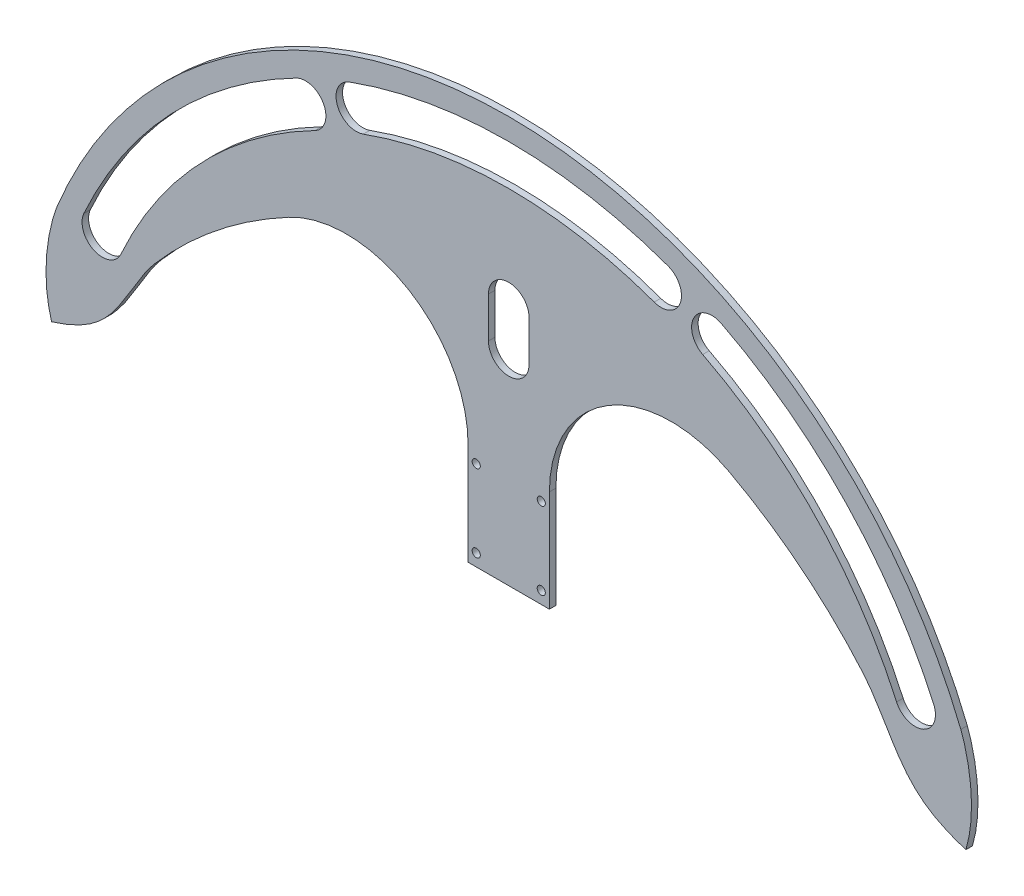
from build123d import *

# Parameters (mm, degrees)
EXTRUDE_2_DEPTH     = 1.6
SKETCH_2_R          = 1
CUT_EXTRUDE_1_DEPTH = 152.556112047


with BuildPart() as part:
    # 草图1 → 凸台-拉伸2 (new body)
    with BuildSketch(Plane.XY):
        with BuildLine():
            Line((-10, 0), (10, 0))
            Line((10, 0), (10, 25))
            ThreePointArc((10, 25), (24.565127337, 50.724787771), (54.117647059, 51.470588235))
            ThreePointArc((54.117647059, 51.470588235), (71.876884233, 39.7703376), (87.177978871, 25))
            add(Edge.make_bspline(
                [(87.177978871, 25), (90.304994573, 21.365241216), (96.247853251, 9.443363931), (103.450341903, 2.775811449), (112.5, 0)],
                knots=[0, 0, 0, 0, 0.44500112, 1, 1, 1, 1], degree=3))
            add(Edge.make_bspline(
                [(111.242977306, 25), (112.528770299, 21.821434652), (115.6681563, 10.742987267), (112.5, 0)],
                knots=[0, 0, 0, 0, 1, 1, 1, 1], degree=3))
            ThreePointArc((111.242977306, 25), (0, 100), (-111.242977306, 25))
            add(Edge.make_bspline(
                [(-111.242977306, 25), (-112.528770299, 21.821434652), (-115.6681563, 10.742987267), (-112.5, 0)],
                knots=[0, 0, 0, 0, 1, 1, 1, 1], degree=3))
            add(Edge.make_bspline(
                [(-87.177978871, 25), (-90.304994573, 21.365241216), (-96.247853251, 9.443363931), (-103.450341903, 2.775811449), (-112.5, 0)],
                knots=[0, 0, 0, 0, 0.44500112, 1, 1, 1, 1], degree=3))
            ThreePointArc((-87.177978871, 25), (-71.876884233, 39.7703376), (-54.117647059, 51.470588235))
            ThreePointArc((-54.117647059, 51.470588235), (-24.565127337, 50.724787771), (-10, 25))
            Line((-10, 25), (-10, 0))
        make_face()
        with BuildLine():
            Line((5, 59.658560997), (5, 49.658560997))
            ThreePointArc((5, 49.658560997), (0, 44.658560997), (-5, 49.658560997))
            Line((-5, 49.658560997), (-5, 59.658560997))
            ThreePointArc((-5, 59.658560997), (0, 64.658560997), (5, 59.658560997))
        make_face(mode=Mode.SUBTRACT)
        with BuildLine():
            ThreePointArc((-52.279803763, 82.046105896), (-83.1008003, 58.999003788), (-104.559607526, 27.051823387))
            ThreePointArc((-104.559607526, 27.051823387), (-102.051823387, 20.440392474), (-95.440392474, 22.948176613))
            ThreePointArc((-95.440392474, 22.948176613), (-75.853125153, 52.10906874), (-47.720196237, 73.146107064))
            ThreePointArc((-47.720196237, 73.146107064), (-45.550000584, 79.875910243), (-52.279803763, 82.046105896))
        make_face(mode=Mode.SUBTRACT)
        with BuildLine():
            ThreePointArc((52.279803763, 82.046105896), (83.1008003, 58.999003788), (104.559607526, 27.051823387))
            ThreePointArc((104.559607526, 27.051823387), (102.051823387, 20.440392474), (95.440392474, 22.948176613))
            ThreePointArc((95.440392474, 22.948176613), (75.853125153, 52.10906874), (47.720196237, 73.146107064))
            ThreePointArc((47.720196237, 73.146107064), (45.550000584, 79.875910243), (52.279803763, 82.046105896))
        make_face(mode=Mode.SUBTRACT)
        with BuildLine():
            ThreePointArc((39.209852822, 87.74587255), (0, 94.658560997), (-39.209852822, 87.74587255))
            ThreePointArc((-39.209852822, 87.74587255), (-42.198553323, 81.337466405), (-35.790147178, 78.348765905))
            ThreePointArc((-35.790147178, 78.348765905), (0, 84.658560997), (35.790147178, 78.348765905))
            ThreePointArc((35.790147178, 78.348765905), (42.198553323, 81.337466405), (39.209852822, 87.74587255))
        make_face(mode=Mode.SUBTRACT)
    extrude(amount=EXTRUDE_2_DEPTH)

    # 草图2 → 切除-拉伸1 (cut, through all)
    with BuildSketch(Plane.XY.offset(1.6)):
        with Locations((-8, 3)):
            Circle(SKETCH_2_R)
        with Locations(Location((8, 3, 0), (0, 0, 180))):
            Circle(SKETCH_2_R)
        with Locations((-8, 22)):
            Circle(SKETCH_2_R)
        with Locations(Location((8, 22, 0), (0, 0, 180))):
            Circle(SKETCH_2_R)
    extrude(amount=-CUT_EXTRUDE_1_DEPTH, mode=Mode.SUBTRACT)


solid = part.part
